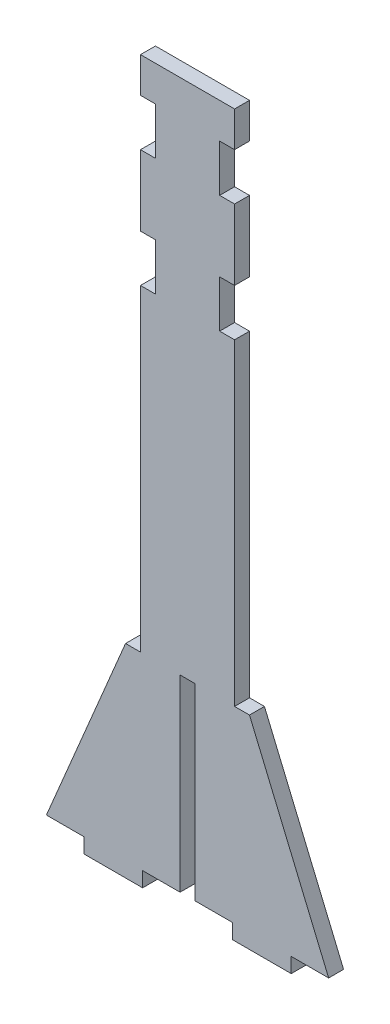
from build123d import *

# Parameters (mm, degrees)
BOSS_EXTRU_1_DEPTH      = 6.35
ENL_V_MAT_EXTRU_1_REACH = 308.007
ESQUISSE2_W             = 6.35
ESQUISSE2_H             = 80
ENL_V_MAT_EXTRU_2_REACH = 308.007
ESQUISSE4_W             = 6.35
ESQUISSE4_H             = 20
SKETCH2_W               = 25
SKETCH2_H               = 6.35
BOSS_EXTRUDE2_DEPTH     = 6.35


with BuildPart() as part:
    # Esquisse1 → Boss.-Extru.1 (new body)
    with BuildSketch(Plane.XY):
        Polygon((-20, 300), (20, 300), (20, 80), (26.35, 80), (60, 0), (-60, 0), (-26.35, 80), (-20, 80), align=None)
    extrude(amount=BOSS_EXTRU_1_DEPTH)

    # Esquisse2 → Enlèv. mat.-Extru.1 (cut, up to next)
    with BuildSketch(Plane.XY.offset(6.35), mode=Mode.PRIVATE) as enl_v_mat_extru_1_sk1:
        with Locations((0, 40)):
            Rectangle(ESQUISSE2_W, ESQUISSE2_H)
    enl_v_mat_extru_1_tool1 = extrude(enl_v_mat_extru_1_sk1.sketch, amount=-ENL_V_MAT_EXTRU_1_REACH, mode=Mode.PRIVATE) & part.part
    add(enl_v_mat_extru_1_tool1.solids().sort_by_distance((0, 40, 6.35))[0], mode=Mode.SUBTRACT)

    # Esquisse4 → Enlèv. mat.-Extru.2 (cut, up to next)
    with BuildSketch(Plane.XY.offset(6.35), mode=Mode.PRIVATE) as enl_v_mat_extru_2_sk1:
        with Locations((16.825, 225)):
            Rectangle(ESQUISSE4_W, ESQUISSE4_H)
    enl_v_mat_extru_2_tool1 = extrude(enl_v_mat_extru_2_sk1.sketch, amount=-ENL_V_MAT_EXTRU_2_REACH, mode=Mode.PRIVATE) & part.part
    # Esquisse4 → Enlèv. mat.-Extru.2 (cut, up to next)
    with BuildSketch(Plane.XY.offset(6.35), mode=Mode.PRIVATE) as enl_v_mat_extru_2_sk2:
        with Locations((-16.825, 225)):
            Rectangle(ESQUISSE4_W, ESQUISSE4_H)
    enl_v_mat_extru_2_tool2 = extrude(enl_v_mat_extru_2_sk2.sketch, amount=-ENL_V_MAT_EXTRU_2_REACH, mode=Mode.PRIVATE) & part.part
    # Esquisse4 → Enlèv. mat.-Extru.2 (cut, up to next)
    with BuildSketch(Plane.XY.offset(6.35), mode=Mode.PRIVATE) as enl_v_mat_extru_2_sk3:
        with Locations((-16.825, 275)):
            Rectangle(ESQUISSE4_W, ESQUISSE4_H)
    enl_v_mat_extru_2_tool3 = extrude(enl_v_mat_extru_2_sk3.sketch, amount=-ENL_V_MAT_EXTRU_2_REACH, mode=Mode.PRIVATE) & part.part
    # Esquisse4 → Enlèv. mat.-Extru.2 (cut, up to next)
    with BuildSketch(Plane.XY.offset(6.35), mode=Mode.PRIVATE) as enl_v_mat_extru_2_sk4:
        with Locations((16.825, 275)):
            Rectangle(ESQUISSE4_W, ESQUISSE4_H)
    enl_v_mat_extru_2_tool4 = extrude(enl_v_mat_extru_2_sk4.sketch, amount=-ENL_V_MAT_EXTRU_2_REACH, mode=Mode.PRIVATE) & part.part
    add(enl_v_mat_extru_2_tool1.solids().sort_by_distance((16.825, 225, 6.35))[0], mode=Mode.SUBTRACT)
    add(enl_v_mat_extru_2_tool2.solids().sort_by_distance((-16.825, 225, 6.35))[0], mode=Mode.SUBTRACT)
    add(enl_v_mat_extru_2_tool3.solids().sort_by_distance((-16.825, 275, 6.35))[0], mode=Mode.SUBTRACT)
    add(enl_v_mat_extru_2_tool4.solids().sort_by_distance((16.825, 275, 6.35))[0], mode=Mode.SUBTRACT)

    # Sketch2 → Boss-Extrude2 (add)
    with BuildSketch(Plane(origin=(0, 0, 0), x_dir=(-1, 0, 0), z_dir=(0, -1, 0))):
        with Locations((31.5875, -3.175)):
            Rectangle(SKETCH2_W, SKETCH2_H)
        with Locations((-31.5875, -3.175)):
            Rectangle(SKETCH2_W, SKETCH2_H)
    extrude(amount=BOSS_EXTRUDE2_DEPTH)


solid = part.part
